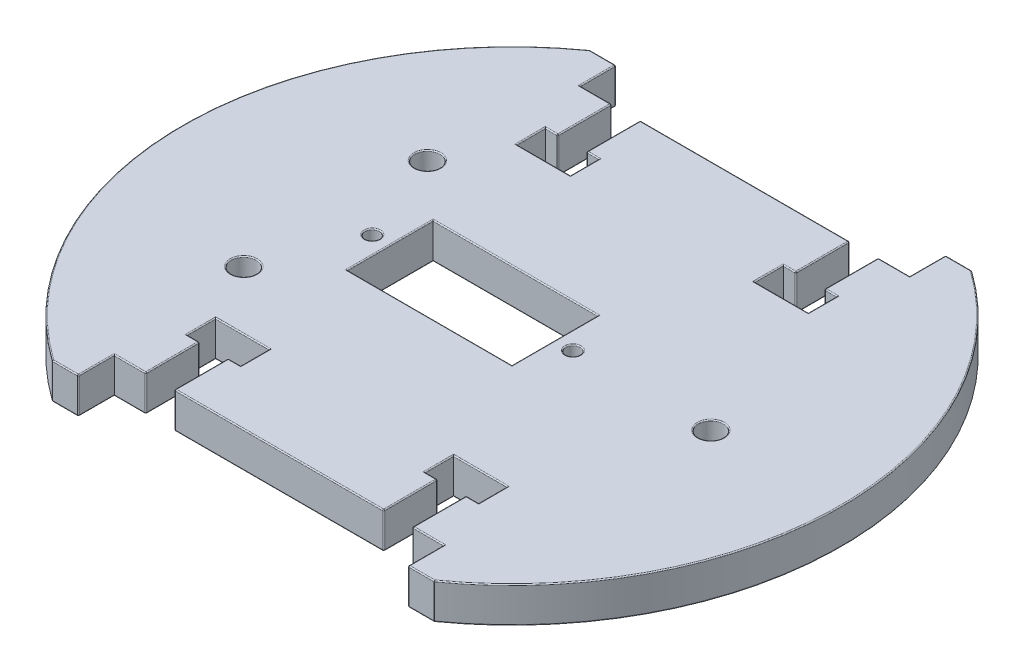
from build123d import *

# Parameters (mm, degrees)
SKETCH_1_R          = 1
SKETCH_1_R_2        = 1.75
SKETCH_1_W          = 23
SKETCH_1_H          = 12
EXTRUDE_1_DEPTH     = 5
SKETCH_3_W          = 4
SKETCH_3_H          = 7.5
SKETCH_3_W_2        = 7.5
SKETCH_3_H_2        = 4
CUT_EXTRUDE_1_DEPTH = 60.558794481
FILLET_1_R          = 0.15


with BuildPart() as part:
    # 草图1 → 凸台-拉伸1 (new body)
    with BuildSketch(Plane(origin=(0, 0, 0), x_dir=(1, 0, 0), z_dir=(0, 1, 0))):
        with BuildLine():
            Line((-26.64113361, 37.5), (-23, 37.5))
            Line((-23, 37.5), (-23, 32.5))
            Line((-23, 32.5), (23, 32.5))
            Line((23, 32.5), (23, 37.5))
            Line((23, 37.5), (26.64113361, 37.5))
            ThreePointArc((26.64113361, 37.5), (46, 0), (26.64113361, -37.5))
            Line((26.64113361, -37.5), (23, -37.5))
            Line((23, -37.5), (23, -32.5))
            Line((23, -32.5), (-23, -32.5))
            Line((-23, -32.5), (-23, -37.5))
            Line((-23, -37.5), (-26.64113361, -37.5))
            ThreePointArc((-26.64113361, -37.5), (-46, 0), (-26.64113361, 37.5))
        make_face()
        with Locations(Location((-19.5, 0, 0), (0, 0, 270))):
            Circle(SKETCH_1_R, mode=Mode.SUBTRACT)
        with Locations(Location((8.5, 0, 0), (0, 0, 270))):
            Circle(SKETCH_1_R, mode=Mode.SUBTRACT)
        with Locations(Location((-24.614550621, 12.813524017, 0), (0, 0, 270))):
            Circle(SKETCH_1_R_2, mode=Mode.SUBTRACT)
        with Locations(Location((-24.614550621, -12.813524017, 0), (0, 0, 270))):
            Circle(SKETCH_1_R_2, mode=Mode.SUBTRACT)
        with Locations(Location((27.748746429, 0, 0), (0, 0, 270))):
            Circle(SKETCH_1_R_2, mode=Mode.SUBTRACT)
        with Locations((-5.5, 0)):
            Rectangle(SKETCH_1_W, SKETCH_1_H, mode=Mode.SUBTRACT)
    extrude(amount=EXTRUDE_1_DEPTH)

    # 草图3 → 切除-拉伸1 (cut, through all)
    with BuildSketch(Plane(origin=(0, 5, 0), x_dir=(1, 0, 0), z_dir=(0, 1, 0))):
        with Locations((-16.6, 28.75)):
            Rectangle(SKETCH_3_W, SKETCH_3_H)
        with Locations((-16.6, 23)):
            Rectangle(SKETCH_3_W_2, SKETCH_3_H_2)
        with Locations((16.6, 23)):
            Rectangle(SKETCH_3_W_2, SKETCH_3_H_2)
        with Locations((16.6, 28.75)):
            Rectangle(SKETCH_3_W, SKETCH_3_H)
        with Locations((-16.6, -28.75)):
            Rectangle(SKETCH_3_W, SKETCH_3_H)
        with Locations((16.6, -28.75)):
            Rectangle(SKETCH_3_W, SKETCH_3_H)
        with Locations((16.6, -23)):
            Rectangle(SKETCH_3_W_2, SKETCH_3_H_2)
        with Locations((-16.6, -23)):
            Rectangle(SKETCH_3_W_2, SKETCH_3_H_2)
    extrude(amount=-CUT_EXTRUDE_1_DEPTH, mode=Mode.SUBTRACT)

    # 圆角1
    fillet_1_edges = [part.edges().sort_by_distance(p)[0] for p in [
        (-23, 5, 35),
        (-18.6, 5, -28.75),
        (-18.6, 2.5, -25),
        (-18.6, 2.5, -32.5),
        (-14.6, 0, -28.75),
        (-14.6, 2.5, -32.5),
        (-13.725, 0, -25),
        (-20.35, 0, -23),
        (-19.475, 0, -25),
        (-18.6, 0, -28.75),
        (-16.6, 5, -21),
        (-12.85, 5, -23),
        (-14.6, 5, -28.75),
        (-16.6, 0, -21),
        (-20.35, 5, -23),
        (-12.85, 0, -23),
        (-14.6, 2.5, -25),
        (-13.725, 5, -25),
        (-19.475, 5, -25),
        (-24.820566805, 0, -37.5),
        (-23, 0, -35),
        (-16.6, 5, 21),
        (-12.85, 5, 23),
        (-20.35, 0, 23),
        (-20.35, 5, 23),
        (-19.475, 5, 25),
        (-18.6, 5, 28.75),
        (-13.725, 5, 25),
        (-16.6, 0, 21),
        (-12.85, 0, 23),
        (-14.6, 0, 28.75),
        (20.8, 0, -32.5),
        (-19.475, 0, 25),
        (-18.6, 2.5, 25),
        (-13.725, 0, 25),
        (-14.6, 2.5, 32.5),
        (-18.6, 0, 28.75),
        (-18.6, 2.5, 32.5),
        (-14.6, 5, 28.75),
        (-14.6, 2.5, 25),
        (23, 0, -35),
        (18.6, 5, 28.75),
        (24.820566805, 0, -37.5),
        (18.6, 2.5, 25),
        (18.6, 2.5, 32.5),
        (14.6, 0, 28.75),
        (14.6, 2.5, 32.5),
        (13.725, 0, 25),
        (20.35, 0, 23),
        (19.475, 0, 25),
        (18.6, 0, 28.75),
        (16.6, 5, 21),
        (12.85, 5, 23),
        (14.6, 5, 28.75),
        (16.6, 0, 21),
        (20.35, 5, 23),
        (46, 0, 0),
        (12.85, 0, 23),
        (14.6, 2.5, 25),
        (13.725, 5, 25),
        (-20.8, 5, 32.5),
        (19.475, 5, 25),
        (24.820566805, 0, 37.5),
        (14.6, 5, -28.75),
        (14.6, 2.5, -25),
        (14.6, 2.5, -32.5),
        (18.6, 0, -28.75),
        (23, 0, 35),
        (18.6, 2.5, -32.5),
        (16.6, 0, -21),
        (12.85, 0, -23),
        (14.6, 0, -28.75),
        (13.725, 5, -25),
        (20.35, 5, -23),
        (19.475, 5, -25),
        (18.6, 5, -28.75),
        (16.6, 5, -21),
        (12.85, 5, -23),
        (20.35, 0, -23),
        (19.475, 0, -25),
        (-20.8, 0, 32.5),
        (18.6, 2.5, -25),
        (13.725, 0, -25),
        (-23, 0, 35),
        (-24.820566805, 0, 37.5),
        (-46, 0, 0),
        (23, 5, 35),
        (24.820566805, 5, 37.5),
        (-26.64113361, 2.5, -37.5),
        (-23, 2.5, -37.5),
        (23, 2.5, -37.5),
        (26.64113361, 2.5, -37.5),
        (26.64113361, 2.5, 37.5),
        (23, 2.5, 37.5),
        (-23, 2.5, 37.5),
        (-26.64113361, 2.5, 37.5),
        (46, 5, 0),
        (24.820566805, 5, -37.5),
        (23, 5, -35),
        (20.8, 5, -32.5),
        (6, 0, 0),
        (-5.5, 0, -6),
        (-17, 0, 0),
        (-5.5, 0, 6),
        (-23, 5, -35),
        (6, 5, 0),
        (-5.5, 5, -6),
        (-17, 5, 0),
        (-5.5, 5, 6),
        (-24.820566805, 5, -37.5),
        (-46, 5, 0),
        (8.5, 0, -1),
        (8.5, 5, -1),
        (-19.5, 0, -1),
        (-19.5, 5, -1),
        (-24.614550621, 0, 11.063524017),
        (-24.614550621, 5, 11.063524017),
        (27.748746429, 0, -1.75),
        (27.748746429, 5, -1.75),
        (-24.614550621, 0, -14.563524017),
        (-24.614550621, 5, -14.563524017),
        (-24.820566805, 5, 37.5),
        (0, 0, -32.5),
        (-20.8, 0, -32.5),
        (0, 5, -32.5),
        (-20.8, 5, -32.5),
        (0, 0, 32.5),
        (20.8, 0, 32.5),
        (0, 5, 32.5),
        (20.8, 5, 32.5),
    ]]
    fillet(fillet_1_edges, radius=FILLET_1_R)


solid = part.part
